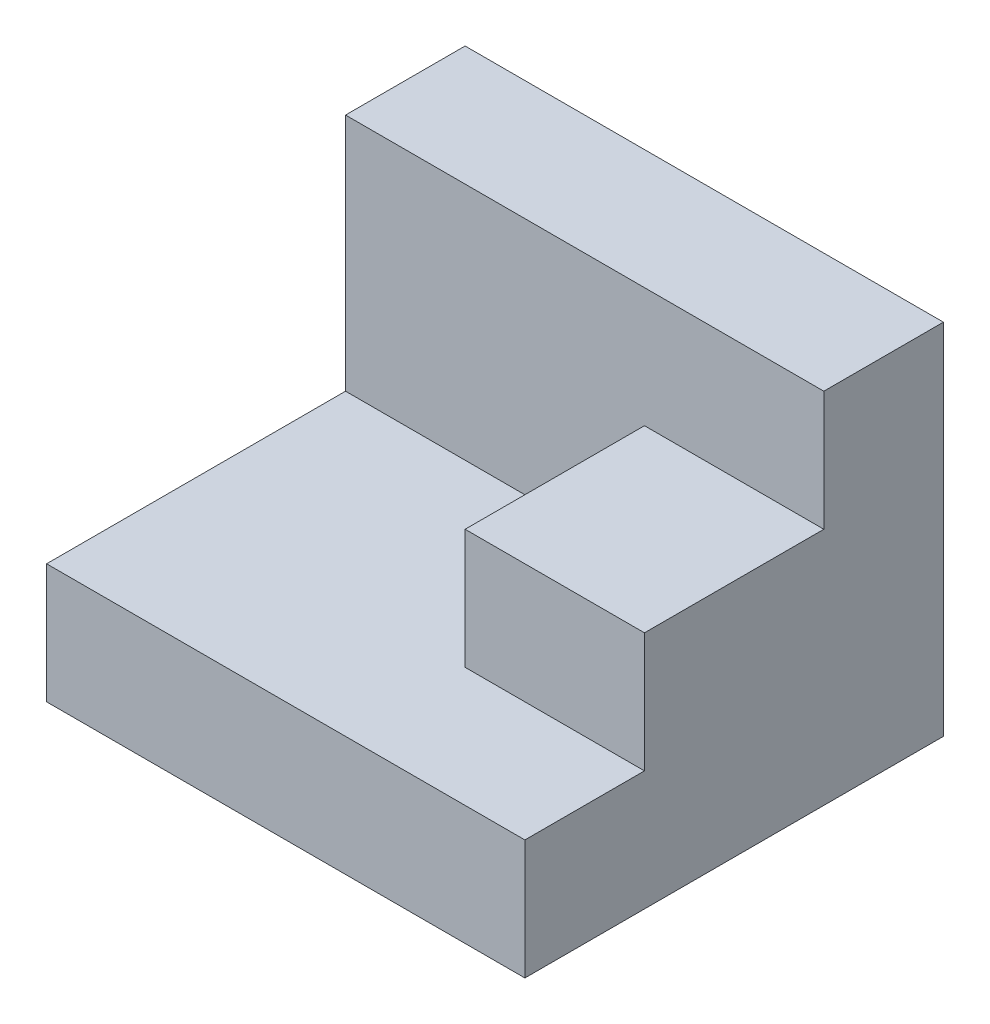
from build123d import *

# Parameters (mm, degrees)
BOSS_EXTRUDE1_DEPTH = 25
SKETCH2_5_W         = 15
SKETCH2_5_H         = 10
BOSS_EXTRUDE2_DEPTH = 15
SKETCH2_7_W         = 40
SKETCH2_7_H         = 30
BOSS_EXTRUDE3_DEPTH = 10


with BuildPart() as part:
    # Sketch2 → Boss-Extrude1 (new body)
    with BuildSketch(Plane.XY):
        Polygon((0, 10), (0, 0), (40, 0), (40, 10), (25, 10), align=None)
    extrude(amount=BOSS_EXTRUDE1_DEPTH)

    # Sketch2<5> → Boss-Extrude2 (add)
    with BuildSketch(Plane.XY):
        with Locations((32.5, 15)):
            Rectangle(SKETCH2_5_W, SKETCH2_5_H)
    extrude(amount=BOSS_EXTRUDE2_DEPTH)

    # Sketch2<7> → Boss-Extrude3 (add)
    with BuildSketch(Plane.XY):
        with Locations((20, 15)):
            Rectangle(SKETCH2_7_W, SKETCH2_7_H)
    extrude(amount=-BOSS_EXTRUDE3_DEPTH)


solid = part.part
